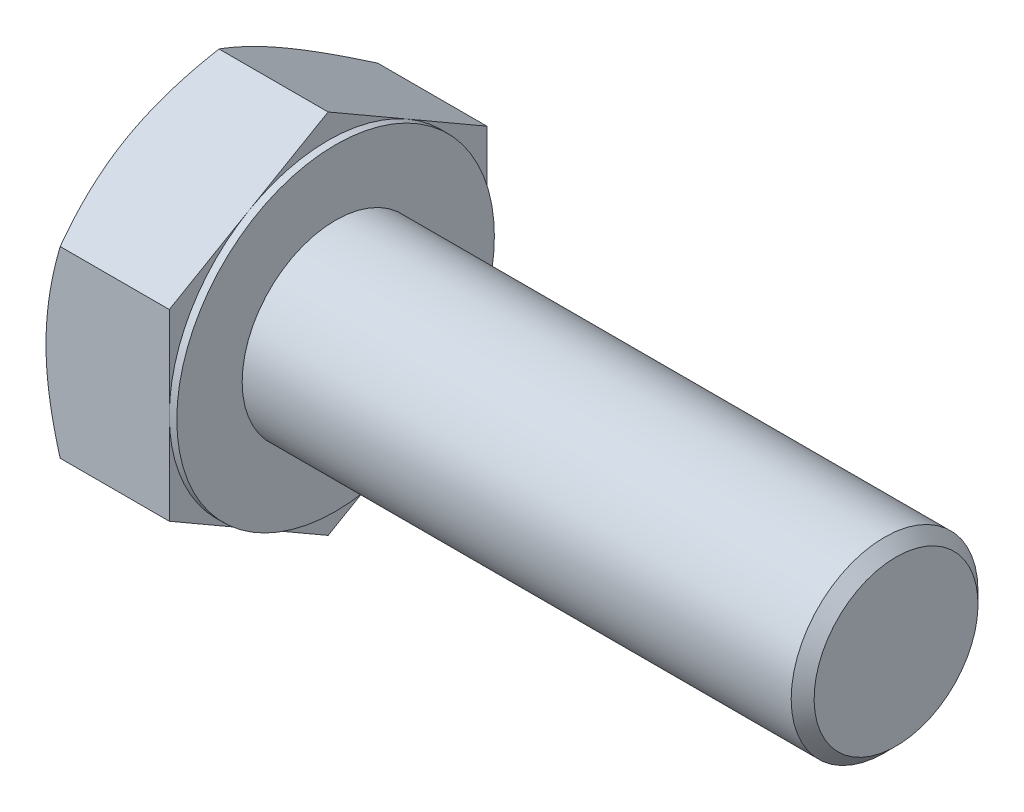
from build123d import *

# Parameters (mm, degrees)
EXTRUDE_559_DEPTH = 6.6
CHAMFER_2_SIZE    = 0.61345
CHAMFER_2_SIZE2   = 0.61355


with BuildPart() as part:
    # 草圖1 → Revolve 409 (revolve)
    with BuildSketch(Plane.XY):
        Polygon((-0.4001, 0), (30, 0), (30, 5), (3, 5), (2.38645, 5), (0, 5), (0, 8.5), (-0.4001, 8.5), align=None)
    revolve(axis=Axis((30, 0, 0), (-1, 0, 0)))

    # 草圖2 → Extrude 559 (add)
    with BuildSketch(Plane.ZY.offset(0.4001)):
        Polygon((0, 9.814954576), (8.5, 4.907477288), (8.5, -4.907477288), (0, -9.814954576), (-8.5, -4.907477288), (-8.5, 4.907477288), align=None)
    extrude(amount=EXTRUDE_559_DEPTH)

    # 草圖3 → Cut-Revolve 678 (revolve, cut)
    with BuildSketch(Plane.XY):
        Polygon((-7.0001, 8.5), (-7.0001, 9.814954576), (-6.240910621, 9.814954576), align=None)
    revolve(axis=Axis((-8.3201, 0, 0), (1, 0, 0)), mode=Mode.SUBTRACT)

    # 倒角2
    chamfer_2_edges = [part.edges().sort_by_distance(p)[0] for p in [
        (30, -5, 0),
    ]]
    chamfer_2_side = [part.faces().sort_by_distance(p)[0] for p in [
        (30, 0, 0),
    ]]
    chamfer(chamfer_2_edges, length=CHAMFER_2_SIZE, length2=CHAMFER_2_SIZE2, reference=chamfer_2_side[0])


solid = part.part
